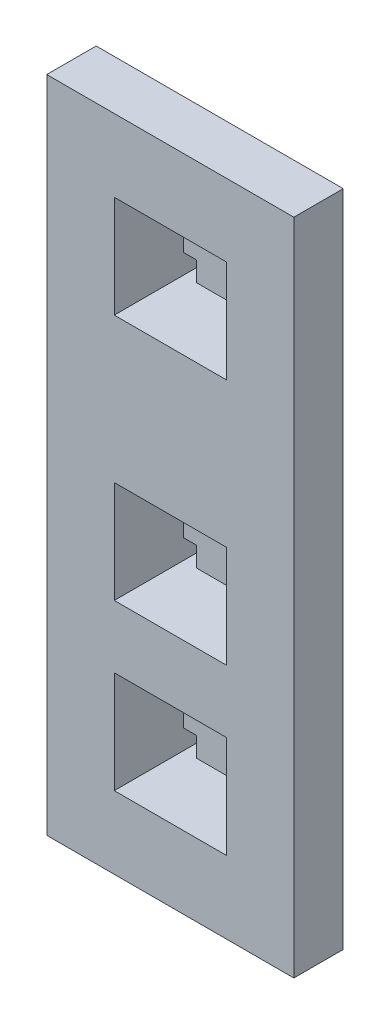
from build123d import *

# Parameters (mm, degrees)
ESQUISSE1_W             = 15
ESQUISSE1_H             = 40
BOSS_EXTRU_1_DEPTH      = 5
ESQUISSE2_W             = 6.8
ESQUISSE2_H             = 6.2
ENL_V_MAT_EXTRU_1_DEPTH = 4.2
ESQUISSE3_W             = 0.8
ESQUISSE3_H             = 1.2
ENL_V_MAT_EXTRU_2_DEPTH = 22.769014677
CHANFREIN1_SIZE         = 2


with BuildPart() as part:
    # Esquisse1 → Boss.-Extru.1 (new body)
    with BuildSketch(Plane.XY):
        Rectangle(ESQUISSE1_W, ESQUISSE1_H)
    extrude(amount=BOSS_EXTRU_1_DEPTH)

    # Esquisse2 → Enlèv. mat.-Extru.1 (cut)
    with BuildSketch(Plane.XY.offset(5)):
        with Locations((0, -2.5)):
            Rectangle(ESQUISSE2_W, ESQUISSE2_H)
        with Locations((0, 12.5)):
            Rectangle(ESQUISSE2_W, ESQUISSE2_H)
        with Locations((0, -12.5)):
            Rectangle(ESQUISSE2_W, ESQUISSE2_H)
    extrude(amount=-ENL_V_MAT_EXTRU_1_DEPTH, mode=Mode.SUBTRACT)

    # Esquisse3 → Enlèv. mat.-Extru.2 (cut, through all)
    with BuildSketch(Plane.XY.offset(0.8)):
        with Locations((-3, 0)):
            Rectangle(ESQUISSE3_W, ESQUISSE3_H)
        with Locations((-3, 10)):
            Rectangle(ESQUISSE3_W, ESQUISSE3_H)
        with Locations((-3, 15)):
            Rectangle(ESQUISSE3_W, ESQUISSE3_H)
        with Locations((3, 15)):
            Rectangle(ESQUISSE3_W, ESQUISSE3_H)
        with Locations((3, 10)):
            Rectangle(ESQUISSE3_W, ESQUISSE3_H)
        with Locations((3, 0)):
            Rectangle(ESQUISSE3_W, ESQUISSE3_H)
        with Locations((3, -5)):
            Rectangle(ESQUISSE3_W, ESQUISSE3_H)
        with Locations((3, -15)):
            Rectangle(ESQUISSE3_W, ESQUISSE3_H)
        with Locations((3, -10)):
            Rectangle(ESQUISSE3_W, ESQUISSE3_H)
        with Locations((-3, -10)):
            Rectangle(ESQUISSE3_W, ESQUISSE3_H)
        with Locations((-3, -15)):
            Rectangle(ESQUISSE3_W, ESQUISSE3_H)
        with Locations((-3, -5)):
            Rectangle(ESQUISSE3_W, ESQUISSE3_H)
    extrude(amount=-ENL_V_MAT_EXTRU_2_DEPTH, mode=Mode.SUBTRACT)

    # Chanfrein1
    chanfrein1_edges = [part.edges().sort_by_distance(p)[0] for p in [
        (0, -20, 0),
        (-7.5, 0, 0),
        (0, 20, 0),
        (7.5, 0, 0),
    ]]
    chamfer(chanfrein1_edges, length=CHANFREIN1_SIZE)


solid = part.part
